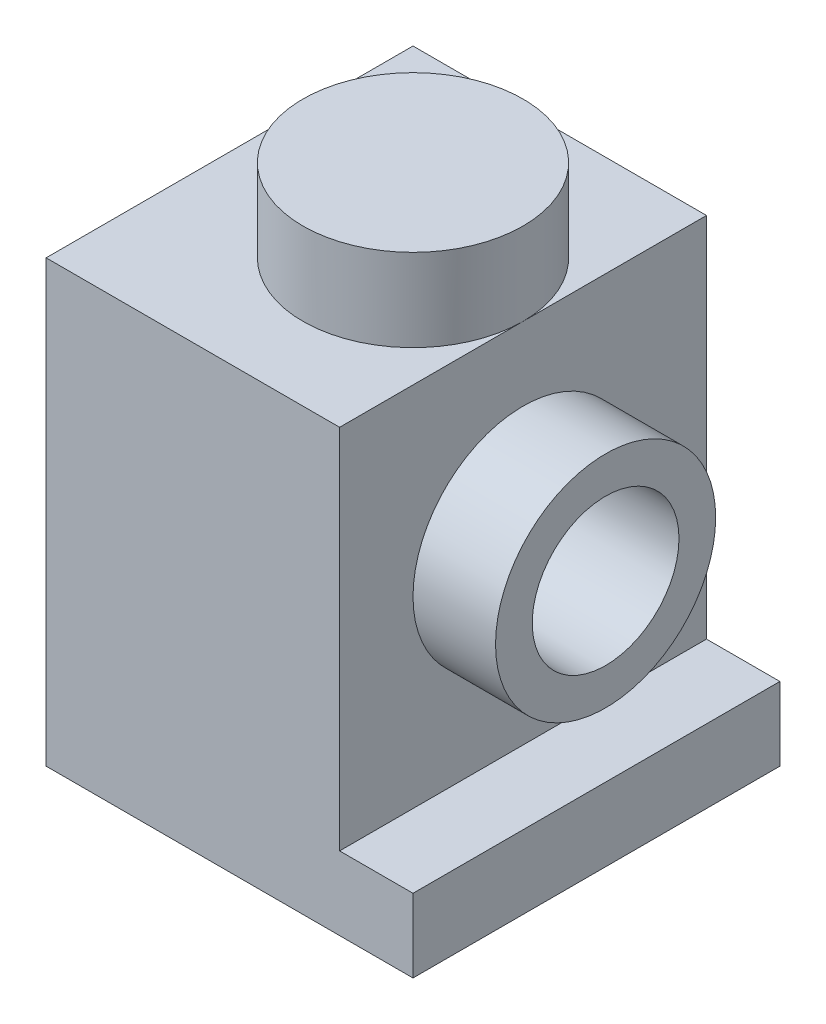
from build123d import *

# Parameters (mm, degrees)
SKETCH_1_W          = 8
SKETCH_1_H          = 8
EXTRUDE_1_DEPTH     = 9.6
SKETCH_2_W          = 1.6
SKETCH_2_H          = 8
CUT_EXTRUDE_1_DEPTH = 8
SKETCH_5_R          = 2.4
EXTRUDE_2_DEPTH     = 1.8
SKETCH_8_R          = 1.6
CUT_EXTRUDE_3_DEPTH = 9
SKETCH_9_R          = 2.4
EXTRUDE_3_DEPTH     = 1.8
SKETCH_13_W         = 4.8
SKETCH_13_H         = 4.803439306
CUT_EXTRUDE_4_DEPTH = 5


with BuildPart() as part:
    # Эскиз1 → Бобышка-Вытянуть1 (new body)
    with BuildSketch(Plane(origin=(0, 0, 0), x_dir=(1, 0, 0), z_dir=(0, 1, 0))):
        Rectangle(SKETCH_1_W, SKETCH_1_H)
    extrude(amount=EXTRUDE_1_DEPTH)

    # Эскиз2 → Вырез-Вытянуть1 (cut)
    with BuildSketch(Plane(origin=(0, 9.6, 0), x_dir=(1, 0, 0), z_dir=(0, 1, 0))):
        with Locations((3.2, 0)):
            Rectangle(SKETCH_2_W, SKETCH_2_H)
    extrude(amount=-CUT_EXTRUDE_1_DEPTH, mode=Mode.SUBTRACT)

    # Эскиз5 → Бобышка-Вытянуть2 (add)
    with BuildSketch(Plane(origin=(2.4, 0, 0), x_dir=(0, 0, -1), z_dir=(1, 0, 0))):
        with Locations(Location((0, 5.6, 0), (0, 0, 180))):
            Circle(SKETCH_5_R)
    extrude(amount=EXTRUDE_2_DEPTH)

    # Эскиз8 → Вырез-Вытянуть3 (cut)
    with BuildSketch(Plane(origin=(4.2, 0, 0), x_dir=(0, 0, -1), z_dir=(1, 0, 0))):
        with Locations((0, 5.6)):
            Circle(SKETCH_8_R)
    extrude(amount=-CUT_EXTRUDE_3_DEPTH, mode=Mode.SUBTRACT)

    # Эскиз9 → Бобышка-Вытянуть3 (add)
    with BuildSketch(Plane(origin=(0, 9.6, 0), x_dir=(1, 0, 0), z_dir=(0, 1, 0))):
        Circle(SKETCH_9_R)
    extrude(amount=EXTRUDE_3_DEPTH)

    # Эскиз13 → Вырез-Вытянуть4 (cut)
    with BuildSketch(Plane.ZY.offset(4)):
        with Locations((0, 5.6)):
            Rectangle(SKETCH_13_W, SKETCH_13_H)
    extrude(amount=-CUT_EXTRUDE_4_DEPTH, mode=Mode.SUBTRACT)


solid = part.part
